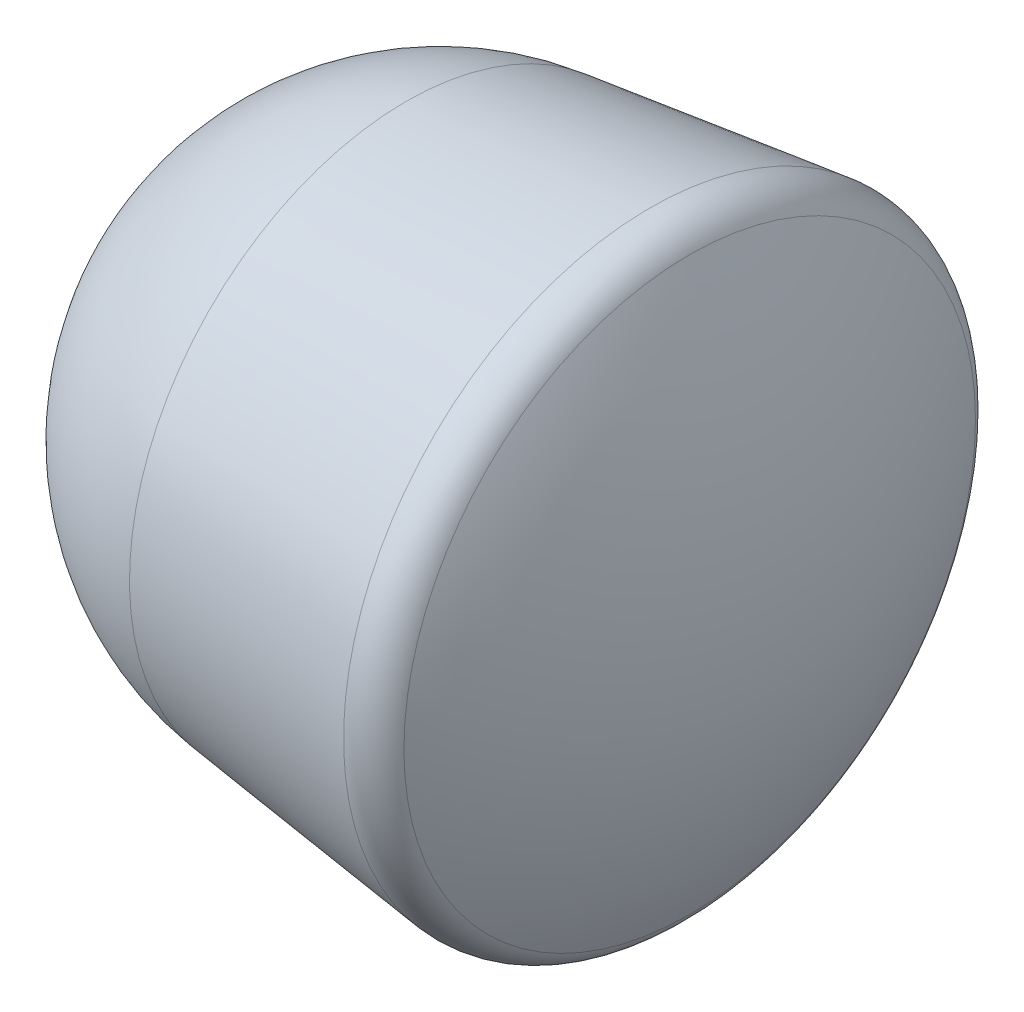
from build123d import *


with BuildPart() as part:
    # Schizzo1 → Rivoluzione1 (revolve)
    with BuildSketch(Plane.XY):
        with BuildLine():
            Line((877.244969062, 991.545063995), (1752.040598457, 1098.95646123))
            ThreePointArc((1752.040598457, 1098.95646123), (1834.533428978, 1083.769011533), (1893.53873752, 1024.15274463))
            ThreePointArc((1893.53873752, 1024.15274463), (2078.996671079, 526.930223864), (2142, 0))
            Line((2142, 0), (0, 0))
            ThreePointArc((0, 0), (250.791074535, 661.951725898), (877.244969062, 991.545063995))
        make_face()
    revolve(axis=Axis((2142, 0, 0), (-1, 0, 0)))


solid = part.part
